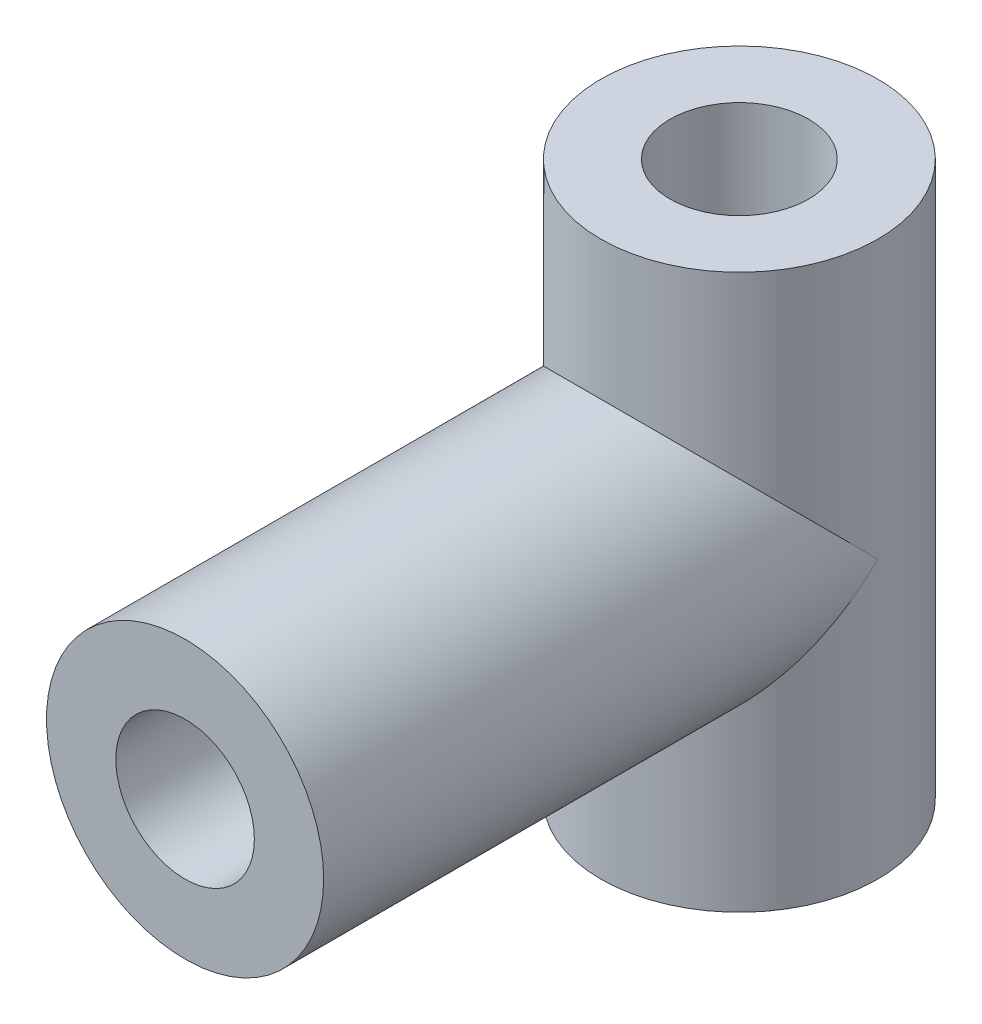
from build123d import *

# Parameters (mm, degrees)
SKETCH_1_R          = 5
EXTRUDE_1_DEPTH     = 10
SKETCH_2_R          = 5
EXTRUDE_2_DEPTH     = 20
SKETCH_3_R          = 2.5
CUT_EXTRUDE_1_DEPTH = 15
SKETCH_4_R          = 2.5
CUT_EXTRUDE_2_DEPTH = 29.722813233


with BuildPart() as part:
    # 草圖1 → 填料-伸長1 (new, symmetric)
    with BuildSketch(Plane(origin=(0, 0, 0), x_dir=(1, 0, 0), z_dir=(0, 1, 0))):
        with Locations(Location((0, 0, 0), (0, 0, 270))):
            Circle(SKETCH_1_R)
    extrude(amount=EXTRUDE_1_DEPTH, both=True)

    # 草圖2 → 填料-伸長2 (add)
    with BuildSketch(Plane.XY):
        Circle(SKETCH_2_R)
    extrude(amount=EXTRUDE_2_DEPTH)

    # 草圖3 → 除料-伸長1 (cut)
    with BuildSketch(Plane.XY.offset(20)):
        Circle(SKETCH_3_R)
    extrude(amount=-CUT_EXTRUDE_1_DEPTH, mode=Mode.SUBTRACT)

    # 草圖4 → 除料-伸長2 (cut, through all)
    with BuildSketch(Plane.XZ.offset(10)):
        with Locations(Location((0, 0, 0), (0, 0, 270))):
            Circle(SKETCH_4_R)
    extrude(amount=-CUT_EXTRUDE_2_DEPTH, mode=Mode.SUBTRACT)


solid = part.part
